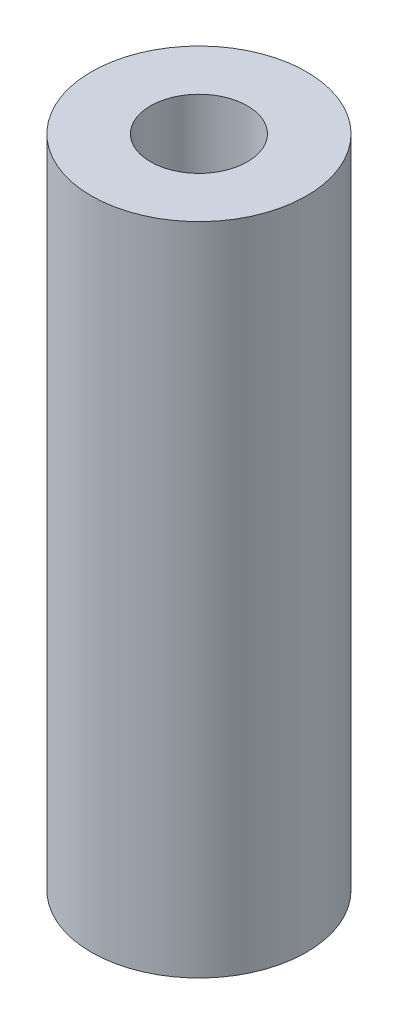
from build123d import *

# Parameters (mm, degrees)
SKETCH1_R                 = 3
BOSS_EXTRUDE1_DEPTH       = 18.27
F_6_32_TAPPED_HOLE1_D     = 2.7051
F_6_32_TAPPED_HOLE1_DEPTH = 10
F_6_32_TAPPED_HOLE1_TIP   = 0.81269403
F_6_32_TAPPED_HOLE2_D     = 2.7051
F_6_32_TAPPED_HOLE2_DEPTH = 10
F_6_32_TAPPED_HOLE2_TIP   = 0.81269403


with BuildPart() as part:
    # Sketch1 → Boss-Extrude1 (new body)
    with BuildSketch(Plane(origin=(0, 0, 0), x_dir=(1, 0, 0), z_dir=(0, 1, 0))):
        with Locations(Location((0, 0, 0), (0, 0, 270))):
            Circle(SKETCH1_R)
    extrude(amount=BOSS_EXTRUDE1_DEPTH)

    # #6-32 Tapped Hole1
    with Locations(Plane(origin=(0, 18.27, 0), x_dir=(1, 0, 0), z_dir=(0, 1, 0))):
        with Locations((0, 0)):
            Hole(F_6_32_TAPPED_HOLE1_D / 2, depth=F_6_32_TAPPED_HOLE1_DEPTH)
            with Locations((0, 0, -(F_6_32_TAPPED_HOLE1_DEPTH + F_6_32_TAPPED_HOLE1_TIP / 2))):  # 118° drill point
                Cone(0, F_6_32_TAPPED_HOLE1_D / 2, F_6_32_TAPPED_HOLE1_TIP, mode=Mode.SUBTRACT)

    # #6-32 Tapped Hole2
    with Locations(Plane(origin=(0, 0, 0), x_dir=(-1, 0, 0), z_dir=(0, -1, 0))):
        with Locations((0, 0)):
            Hole(F_6_32_TAPPED_HOLE2_D / 2, depth=F_6_32_TAPPED_HOLE2_DEPTH)
            with Locations((0, 0, -(F_6_32_TAPPED_HOLE2_DEPTH + F_6_32_TAPPED_HOLE2_TIP / 2))):  # 118° drill point
                Cone(0, F_6_32_TAPPED_HOLE2_D / 2, F_6_32_TAPPED_HOLE2_TIP, mode=Mode.SUBTRACT)


solid = part.part
